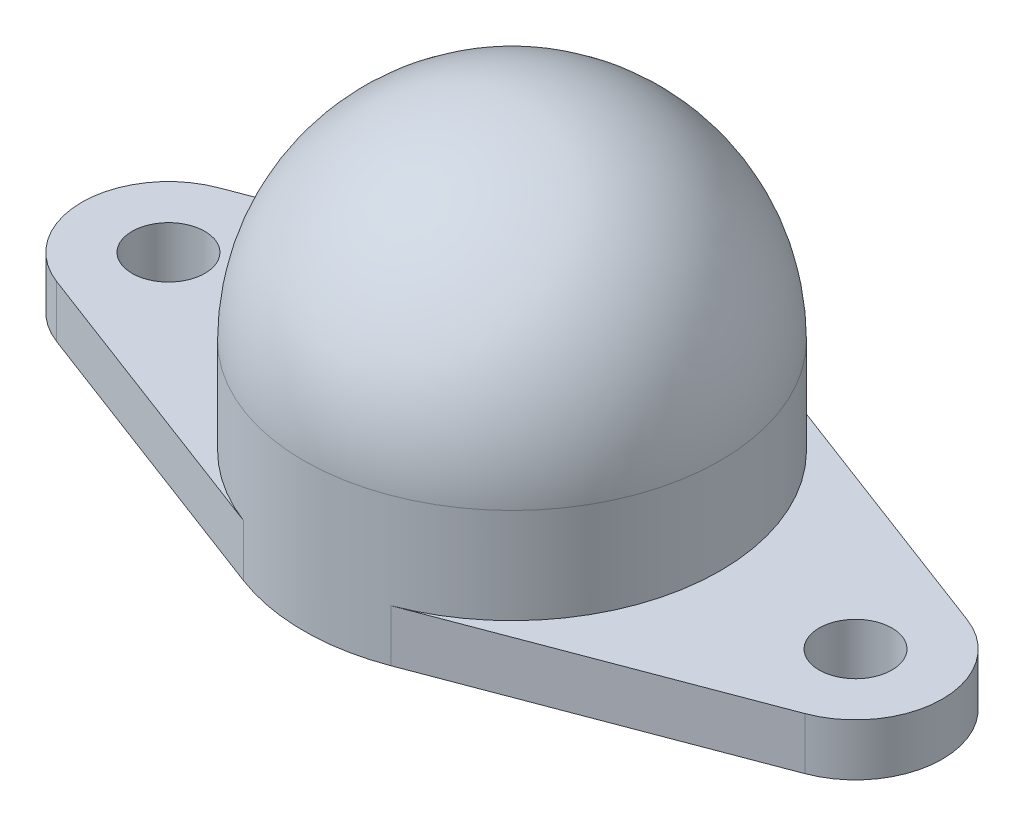
from build123d import *

# Parameters (mm, degrees)
SKETCH1_R           = 2.1
BOSS_EXTRUDE1_DEPTH = 3
SKETCH2_R           = 12
BOSS_EXTRUDE3_DEPTH = 17.5
FILLET1_R           = 12


with BuildPart() as part:
    # Sketch1 → Boss-Extrude1 (new body)
    with BuildSketch(Plane(origin=(0, 0, 0), x_dir=(1, 0, 0), z_dir=(0, 1, 0))):
        with BuildLine():
            Line((-21.567676768, 4.677105819), (-4.242424242, 11.225053966))
            ThreePointArc((-4.242424242, 11.225053966), (0, 12), (4.242424242, 11.225053966))
            Line((4.242424242, 11.225053966), (21.567676768, 4.677105819))
            ThreePointArc((21.567676768, 4.677105819), (24.8, 0), (21.567676768, -4.677105819))
            Line((21.567676768, -4.677105819), (4.242424242, -11.225053966))
            ThreePointArc((4.242424242, -11.225053966), (0, -12), (-4.242424242, -11.225053966))
            Line((-4.242424242, -11.225053966), (-21.567676768, -4.677105819))
            ThreePointArc((-21.567676768, -4.677105819), (-24.8, 0), (-21.567676768, 4.677105819))
        make_face()
        with Locations(Location((-19.8, 0, 0), (0, 0, 270))):
            Circle(SKETCH1_R, mode=Mode.SUBTRACT)
        with Locations(Location((19.8, 0, 0), (0, 0, 90))):
            Circle(SKETCH1_R, mode=Mode.SUBTRACT)
    extrude(amount=BOSS_EXTRUDE1_DEPTH)

    # Sketch2 → Boss-Extrude3 (add)
    with BuildSketch(Plane(origin=(0, 3, 0), x_dir=(1, 0, 0), z_dir=(0, 1, 0))):
        with Locations(Location((0, 0, 0), (0, 0, 69.296293743))):
            Circle(SKETCH2_R)
    extrude(amount=BOSS_EXTRUDE3_DEPTH)

    # Fillet1
    fillet1_edges = [part.edges().sort_by_distance(p)[0] for p in [
        (-4.242424242, 20.5, 11.225053966),
    ]]
    fillet(fillet1_edges, radius=FILLET1_R)


solid = part.part
